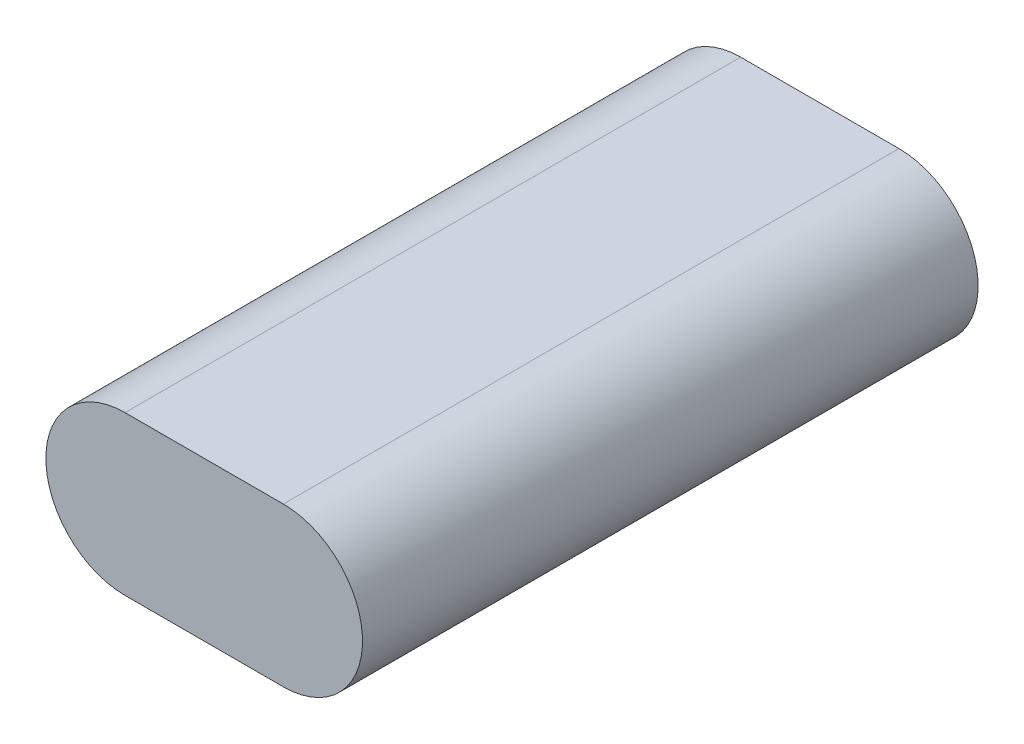
from build123d import *

# Parameters (mm, degrees)
BOSS_EXTRUDE1_DEPTH = 70


with BuildPart() as part:
    # Sketch1 → Boss-Extrude1 (new body)
    with BuildSketch(Plane.XY):
        with BuildLine():
            Line((-9, 9), (9, 9))
            ThreePointArc((9, 9), (18, 0), (9, -9))
            Line((9, -9), (-9, -9))
            ThreePointArc((-9, -9), (-18, 0), (-9, 9))
        make_face()
    extrude(amount=BOSS_EXTRUDE1_DEPTH)


solid = part.part
